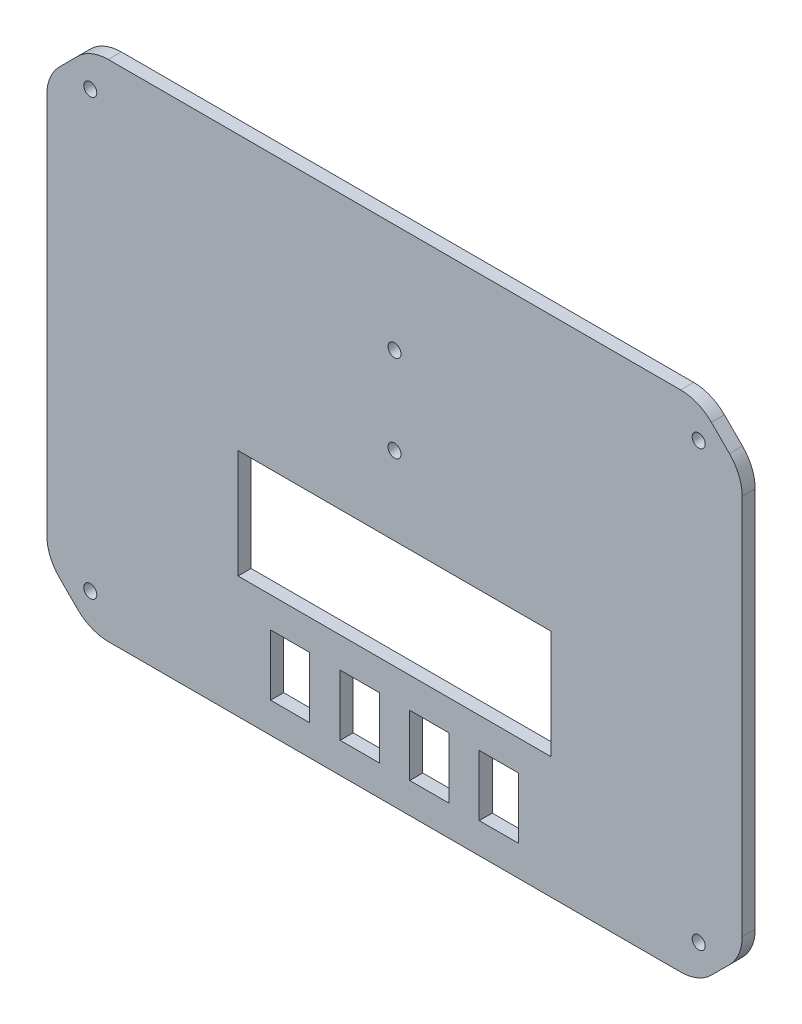
from build123d import *

# Parameters (mm, degrees)
BOSS_EXTRUDE1_DEPTH     = 3
CUT_EXTRUDE1_DEPTH      = 141.943250991
CUT_EXTRUDE1_DEPTH_BACK = 3
CUT_EXTRUDE2_DEPTH      = 141.943250991
CUT_EXTRUDE2_DEPTH_BACK = 3
SKETCH5_R               = 1.5
SKETCH5_W               = 72
SKETCH5_H               = 25
SKETCH5_W_2             = 9
SKETCH5_H_2             = 14
CUT_EXTRUDE3_DEPTH      = 141.943250991
FILLET1_R               = 10


with BuildPart() as part:
    # Sketch1 → Boss-Extrude1 (new body)
    with BuildSketch(Plane.XY):
        Polygon((80, 116), (-80, 116), (-80, 10), (-70, 0), (70, 0), (80, 10), align=None)
    extrude(amount=BOSS_EXTRUDE1_DEPTH)

    # Sketch3 → Cut-Extrude1 (cut, two sides: drawn at the far end of the back side and taken through both)
    with BuildSketch(Plane(origin=(0, 0, 0), x_dir=(-1, 0, 0), z_dir=(0, 0, -1)).offset(-CUT_EXTRUDE1_DEPTH_BACK)):
        Polygon((-358.49693246, -172.49693246), (-80, 106), (-70, 116), (208.49693246, 394.49693246), (-348.49693246, 951.49079738), (-915.49079738, 384.49693246), align=None)
    extrude(amount=CUT_EXTRUDE1_DEPTH + CUT_EXTRUDE1_DEPTH_BACK, mode=Mode.SUBTRACT)

    # Sketch4 → Cut-Extrude2 (cut, two sides: drawn at the far end of the back side and taken through both)
    with BuildSketch(Plane(origin=(0, 0, 0), x_dir=(-1, 0, 0), z_dir=(0, 0, -1)).offset(-CUT_EXTRUDE2_DEPTH_BACK)):
        Polygon((-208.49693246, 394.49693246), (70, 116), (80, 106), (358.49693246, -172.49693246), (915.49079738, 384.49693246), (348.49693246, 951.49079738), align=None)
    extrude(amount=CUT_EXTRUDE2_DEPTH + CUT_EXTRUDE2_DEPTH_BACK, mode=Mode.SUBTRACT)

    # Sketch5 → Cut-Extrude3 (cut, through all)
    with BuildSketch(Plane(origin=(0, 0, 0), x_dir=(-1, 0, 0), z_dir=(0, 0, -1))):
        with Locations((0, 91)):
            Circle(SKETCH5_R)
        with Locations((0, 71)):
            Circle(SKETCH5_R)
        with Locations((-70, 8)):
            Circle(SKETCH5_R)
        with Locations((70, 8)):
            Circle(SKETCH5_R)
        with Locations((70, 108)):
            Circle(SKETCH5_R)
        with Locations((-70, 108)):
            Circle(SKETCH5_R)
        with Locations((0, 40.5)):
            Rectangle(SKETCH5_W, SKETCH5_H)
        with Locations((-24, 14)):
            Rectangle(SKETCH5_W_2, SKETCH5_H_2)
        with Locations((-8, 14)):
            Rectangle(SKETCH5_W_2, SKETCH5_H_2)
        with Locations((8, 14)):
            Rectangle(SKETCH5_W_2, SKETCH5_H_2)
        with Locations((24, 14)):
            Rectangle(SKETCH5_W_2, SKETCH5_H_2)
    extrude(amount=-CUT_EXTRUDE3_DEPTH, mode=Mode.SUBTRACT)

    # Fillet1
    fillet1_edges = [part.edges().sort_by_distance(p)[0] for p in [
        (-80, 10, 1.5),
        (80, 10, 1.5),
        (70, 0, 1.5),
        (-70, 0, 1.5),
        (80, 106, 1.5),
        (70, 116, 1.5),
        (-70, 116, 1.5),
        (-80, 106, 1.5),
    ]]
    fillet(fillet1_edges, radius=FILLET1_R)


solid = part.part
